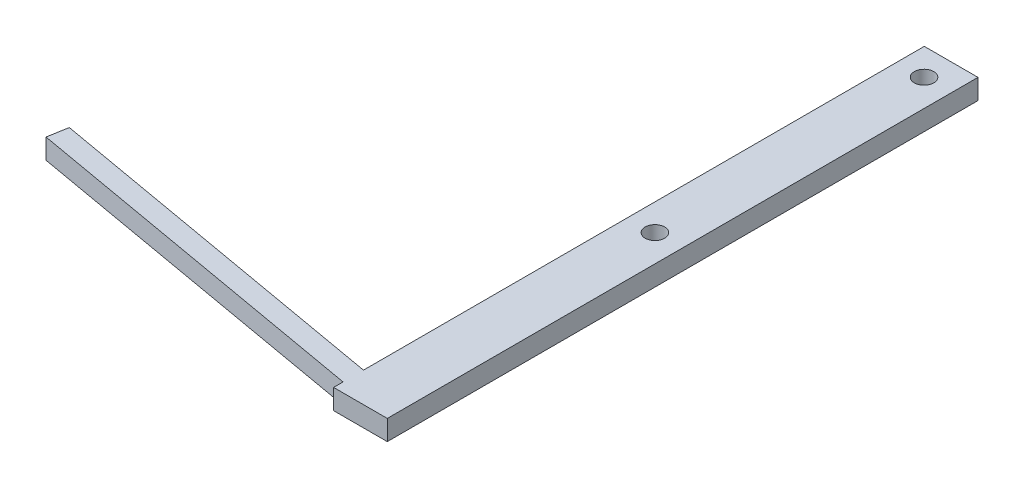
from build123d import *

# Parameters (mm, degrees)
SKETCH1_W           = 12.7
SKETCH1_H           = 139.7
SKETCH1_R           = 2.31
BOSS_EXTRUDE1_DEPTH = 4.7625
BOSS_EXTRUDE2_DEPTH = 4.7625


with BuildPart() as part:
    # Sketch1 → Boss-Extrude1 (new body)
    with BuildSketch(Plane(origin=(0, 0, 0), x_dir=(1, 0, 0), z_dir=(0, 1, 0))):
        with Locations((6.35, 31.687542426)):
            Rectangle(SKETCH1_W, SKETCH1_H)
        with Locations(Location((6.293214881, 95.187542426, 0), (0, 0, 90))):
            Circle(SKETCH1_R, mode=Mode.SUBTRACT)
        with Locations(Location((6.293214881, 31.537542426, 0), (0, 0, 90))):
            Circle(SKETCH1_R, mode=Mode.SUBTRACT)
    extrude(amount=BOSS_EXTRUDE1_DEPTH)

    # Sketch2 → Boss-Extrude2 (add)
    with BuildSketch(Plane.XZ):
        Polygon((0, 31.08713568), (0, 35.923104919), (-85.288371425, 20.884463896), (-84.461371979, 16.194316973), align=None)
    extrude(amount=-BOSS_EXTRUDE2_DEPTH)


solid = part.part
